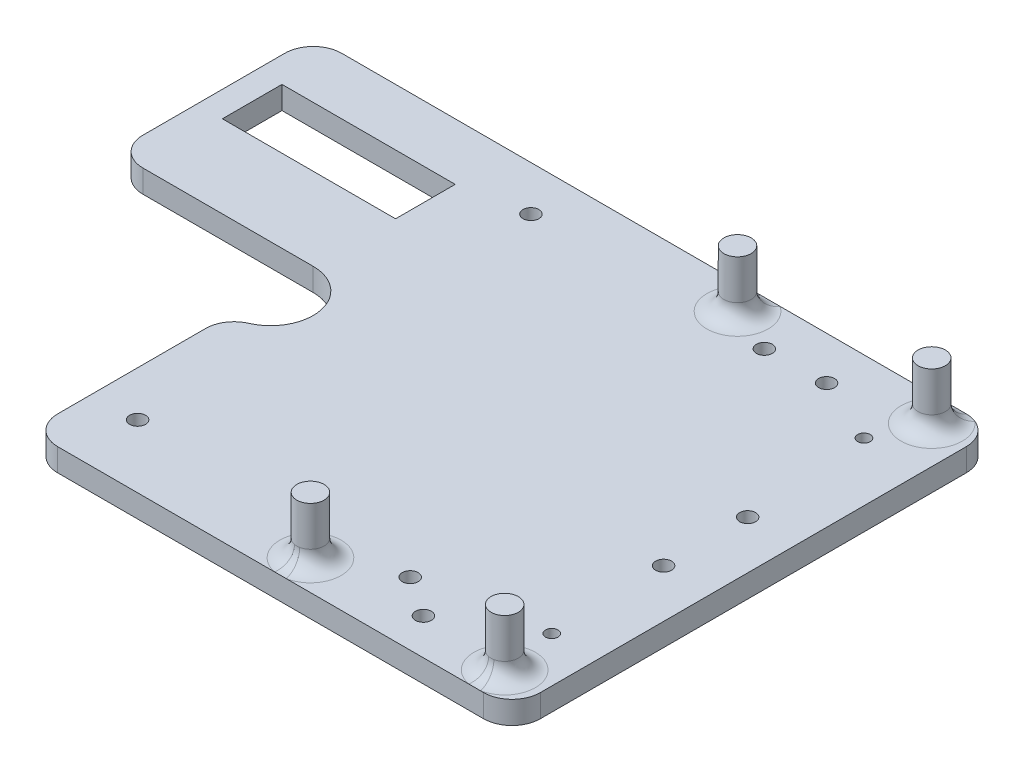
from build123d import *

# Parameters (mm, degrees)
SKETCH2_W               = 30.5
SKETCH2_H               = 10.5
BOSS_EXTRUDE1_DEPTH     = 4
FILLET1_R               = 5
SKETCH3_R               = 2.4
BOSS_EXTRUDE2_DEPTH     = 10
CUT_EXTRUDE1_DEPTH      = 148.39402973
CUT_EXTRUDE1_DEPTH_BACK = 148.39402973
SKETCH4_R               = 1.4
SKETCH4_R_2             = 1.1
CUT_EXTRUDE2_DEPTH      = 148.719328458
CUT_EXTRUDE2_DEPTH_BACK = 148.719328458
SKETCH5_R               = 1.4
FILLET2_R               = 3
FILLET3_R               = 3
FILLET4_R               = 3


with BuildPart() as part:
    # Sketch2 → Boss-Extrude1 (new body)
    with BuildSketch(Plane(origin=(0, 0, 0), x_dir=(1, 0, 0), z_dir=(0, 1, 0))):
        with BuildLine():
            Line((-120, 50), (-85, 50))
            ThreePointArc((-85, 50), (-77.5, 42.5), (-85, 35))
            Line((-85, 35), (-85, 0))
            Line((-85, 0), (0, 0))
            Line((0, 0), (0, 85))
            Line((0, 85), (-120, 85))
            Line((-120, 85), (-120, 50))
        make_face()
        with Locations((-100.25, 69.75)):
            Rectangle(SKETCH2_W, SKETCH2_H, mode=Mode.SUBTRACT)
    extrude(amount=BOSS_EXTRUDE1_DEPTH)

    # Fillet1
    fillet1_edges = [part.edges().sort_by_distance(p)[0] for p in [
        (0, 2, 0),
        (-85, 2, 0),
        (-85, 2, -35),
        (-120, 2, -50),
        (-120, 2, -85),
        (0, 2, -85),
    ]]
    fillet(fillet1_edges, radius=FILLET1_R)

    # Sketch3 → Boss-Extrude2 (add)
    with BuildSketch(Plane(origin=(0, 4, 0), x_dir=(1, 0, 0), z_dir=(0, 1, 0))):
        with Locations(Location((-6.586230152, 80.5, 0), (0, 0, 90))):
            Circle(SKETCH3_R)
        with Locations(Location((-40.786230152, 80.5, 0), (0, 0, 90))):
            Circle(SKETCH3_R)
        with Locations(Location((-40.786230152, 5.300086959, 0), (0, 0, 90))):
            Circle(SKETCH3_R)
        with Locations(Location((-6.586230152, 5.3, 0), (0, 0, 90))):
            Circle(SKETCH3_R)
    extrude(amount=BOSS_EXTRUDE2_DEPTH)

    # Sketch4 → Cut-Extrude1 (cut, two sides: drawn at the far end of the back side and taken through both)
    with BuildSketch(Plane(origin=(0, 4, 0), x_dir=(1, 0, 0), z_dir=(0, 1, 0)).offset(-CUT_EXTRUDE1_DEPTH_BACK)):
        with Locations(Location((-8.5, 50, 0), (0, 0, 270))):
            Circle(SKETCH4_R)
        with Locations(Location((-8.5, 35.2, 0), (0, 0, 270))):
            Circle(SKETCH4_R)
        with Locations(Location((-8, 15, 0), (0, 0, 270))):
            Circle(SKETCH4_R_2)
        with Locations(Location((-22, 6.4, 0), (0, 0, 270))):
            Circle(SKETCH4_R)
        with Locations(Location((-22, 77.4, 0), (0, 0, 270))):
            Circle(SKETCH4_R)
        with Locations(Location((-10.315869942, 72.297665639, 0), (0, 0, 270))):
            Circle(SKETCH4_R_2)
    extrude(amount=CUT_EXTRUDE1_DEPTH + CUT_EXTRUDE1_DEPTH_BACK, mode=Mode.SUBTRACT)

    # Sketch5 → Cut-Extrude2 (cut, two sides: drawn at the far end of the back side and taken through both)
    with BuildSketch(Plane.XZ.offset(-CUT_EXTRUDE2_DEPTH_BACK)):
        with Locations(Location((-32.695307694, -77.13410082, 0), (0, 0, 270))):
            Circle(SKETCH5_R)
        with Locations(Location((-73.795307694, -77.13410082, 0), (0, 0, 270))):
            Circle(SKETCH5_R)
        with Locations(Location((-77.058410355, -11.13410082, 0), (0, 0, 270))):
            Circle(SKETCH5_R)
        with Locations(Location((-29.058410355, -11.13410082, 0), (0, 0, 270))):
            Circle(SKETCH5_R)
    extrude(amount=CUT_EXTRUDE2_DEPTH + CUT_EXTRUDE2_DEPTH_BACK, mode=Mode.SUBTRACT)

    # Fillet2
    fillet2_edges = [part.edges().sort_by_distance(p)[0] for p in [
        (-6.586230152, 4, -2.9),
    ]]
    fillet(fillet2_edges, radius=FILLET2_R)

    # Fillet3
    fillet3_edges = [part.edges().sort_by_distance(p)[0] for p in [
        (-40.786230152, 4, -2.900086959),
    ]]
    fillet(fillet3_edges, radius=FILLET3_R)

    # Fillet4
    fillet4_edges = [part.edges().sort_by_distance(p)[0] for p in [
        (-6.586230152, 4, -78.1),
        (-40.786230152, 4, -78.1),
    ]]
    fillet(fillet4_edges, radius=FILLET4_R)


solid = part.part
